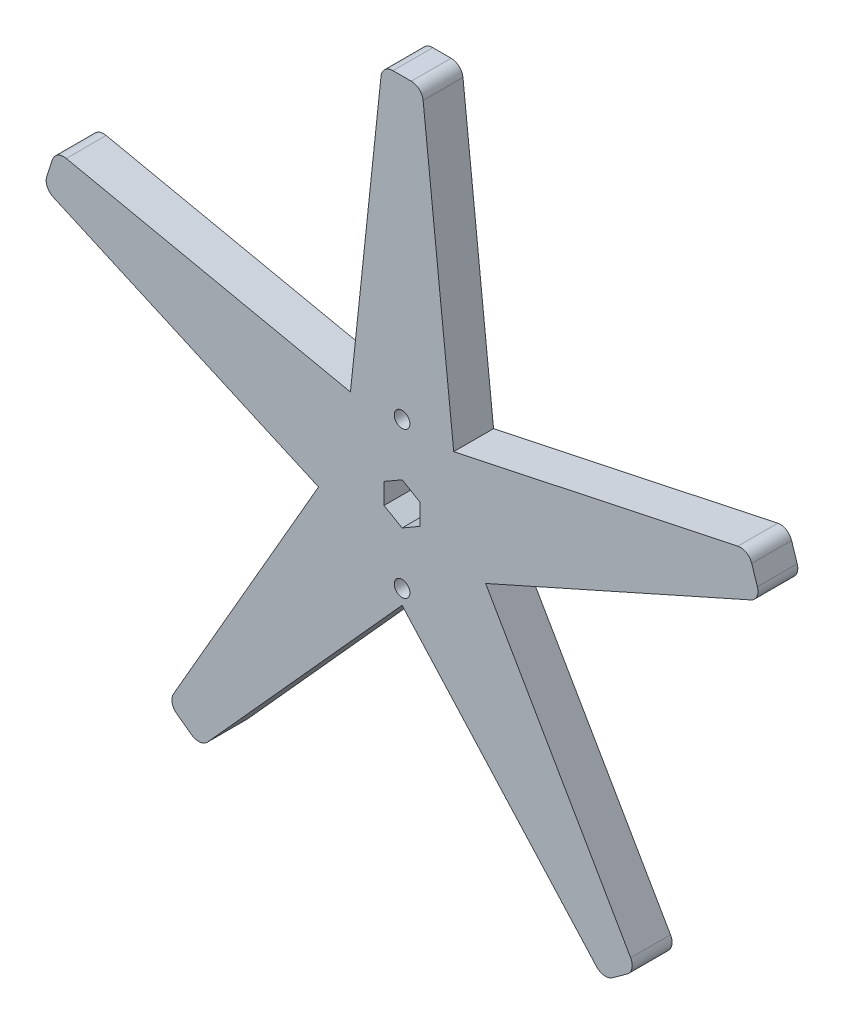
from build123d import *

# Parameters (mm, degrees)
SKETCH1_R           = 2.5
BOSS_EXTRUDE1_DEPTH = 12.7


with BuildPart() as part:
    # Sketch1 → Boss-Extrude1 (new body)
    with BuildSketch(Plane.XY):
        with BuildLine():
            Line((-2.922024956, 118.140407077), (2.922024956, 118.140407077))
            ThreePointArc((2.922024956, 118.140407077), (5.470359591, 117.162736611), (6.710856163, 114.731478252))
            Line((6.710856163, 114.731478252), (16.457987064, 22.652475842))
            Line((16.457987064, 22.652475842), (107.042351415, 41.836380053))
            ThreePointArc((107.042351415, 41.836380053), (109.737950042, 41.407897856), (111.455248619, 39.286404385))
            Line((111.455248619, 39.286404385), (113.261159358, 33.728382634))
            ThreePointArc((113.261159358, 33.728382634), (113.1188182, 31.002655585), (111.189888617, 29.071573086))
            Line((111.189888617, 29.071573086), (26.629582456, -8.652475842))
            Line((26.629582456, -8.652475842), (72.866667573, -88.875173413))
            ThreePointArc((72.866667573, -88.875173413), (73.292142573, -91.571248333), (71.805156827, -93.860073872))
            Line((71.805156827, -93.860073872), (67.077221132, -97.295120224))
            ThreePointArc((67.077221132, -97.295120224), (64.440914824, -98.002041718), (62.008274208, -96.764257979))
            Line((62.008274208, -96.764257979), (0, -28))
            Line((0, -28), (-62.008274208, -96.764257979))
            ThreePointArc((-62.008274208, -96.764257979), (-64.440914824, -98.002041718), (-67.077221132, -97.295120224))
            Line((-67.077221132, -97.295120224), (-71.805156827, -93.860073872))
            ThreePointArc((-71.805156827, -93.860073872), (-73.292142573, -91.571248333), (-72.866667573, -88.875173413))
            Line((-72.866667573, -88.875173413), (-26.629582456, -8.652475842))
            Line((-26.629582456, -8.652475842), (-111.189888617, 29.071573086))
            ThreePointArc((-111.189888617, 29.071573086), (-113.1188182, 31.002655585), (-113.261159358, 33.728382634))
            Line((-113.261159358, 33.728382634), (-111.455248619, 39.286404385))
            ThreePointArc((-111.455248619, 39.286404385), (-109.737950042, 41.407897856), (-107.042351415, 41.836380053))
            Line((-107.042351415, 41.836380053), (-16.457987064, 22.652475842))
            Line((-16.457987064, 22.652475842), (-6.710856163, 114.731478252))
            ThreePointArc((-6.710856163, 114.731478252), (-5.470359591, 117.162736611), (-2.922024956, 118.140407077))
        make_face()
        with Locations((0, 23.341182104)):
            Circle(SKETCH1_R, mode=Mode.SUBTRACT)
        with Locations((0, -23.341182104)):
            Circle(SKETCH1_R, mode=Mode.SUBTRACT)
        Polygon((0, -6.65), (5.759068935, -3.325), (5.759068935, 3.325), (0, 6.65), (-5.759068935, 3.325), (-5.759068935, -3.325), align=None, mode=Mode.SUBTRACT)
    extrude(amount=BOSS_EXTRUDE1_DEPTH)


solid = part.part
